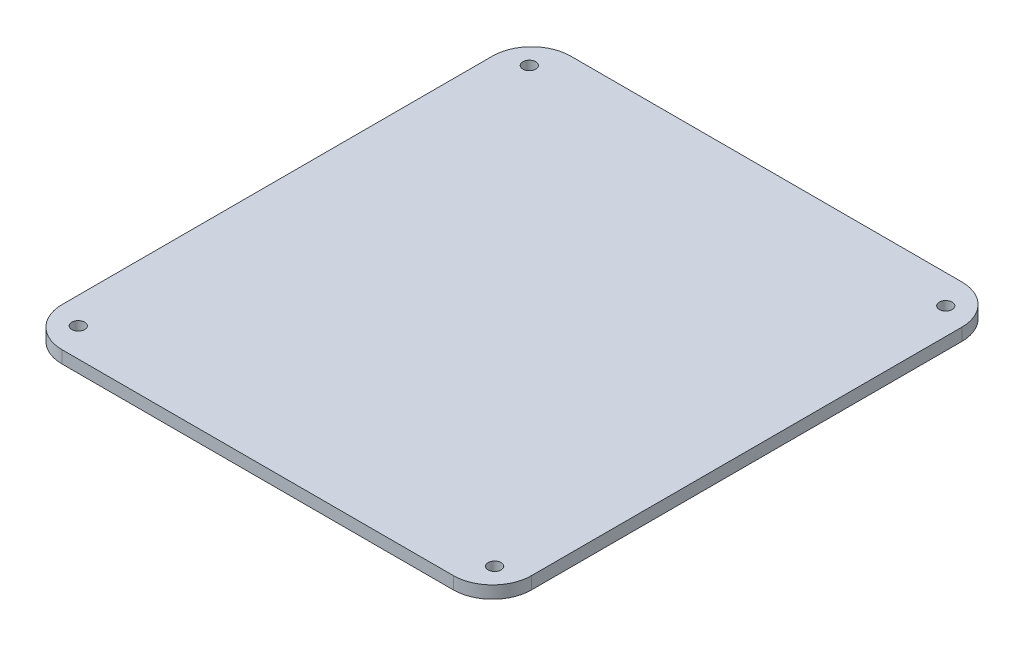
from build123d import *

# Parameters (mm, degrees)
SKETCH1_W           = 120
SKETCH1_H           = 130
SKETCH1_R           = 1.65
BOSS_EXTRUDE1_DEPTH = 3.175
FILLET1_R           = 10


with BuildPart() as part:
    # Sketch1 → Boss-Extrude1 (new body)
    with BuildSketch(Plane(origin=(0, 0, 0), x_dir=(1, 0, 0), z_dir=(0, 1, 0))):
        Rectangle(SKETCH1_W, SKETCH1_H)
        with Locations(Location((53.217198973, -57.651965554, 0), (0, 0, 270))):
            Circle(SKETCH1_R, mode=Mode.SUBTRACT)
        with Locations(Location((53.217198973, 57.651965554, 0), (0, 0, 270))):
            Circle(SKETCH1_R, mode=Mode.SUBTRACT)
        with Locations(Location((-53.217198973, -57.651965554, 0), (0, 0, 270))):
            Circle(SKETCH1_R, mode=Mode.SUBTRACT)
        with Locations(Location((-53.217198973, 57.651965554, 0), (0, 0, 270))):
            Circle(SKETCH1_R, mode=Mode.SUBTRACT)
    extrude(amount=BOSS_EXTRUDE1_DEPTH)

    # Fillet1
    fillet1_edges = [part.edges().sort_by_distance(p)[0] for p in [
        (60, 1.5875, 65),
        (-60, 1.5875, 65),
        (-60, 1.5875, -65),
        (60, 1.5875, -65),
    ]]
    fillet(fillet1_edges, radius=FILLET1_R)


solid = part.part
